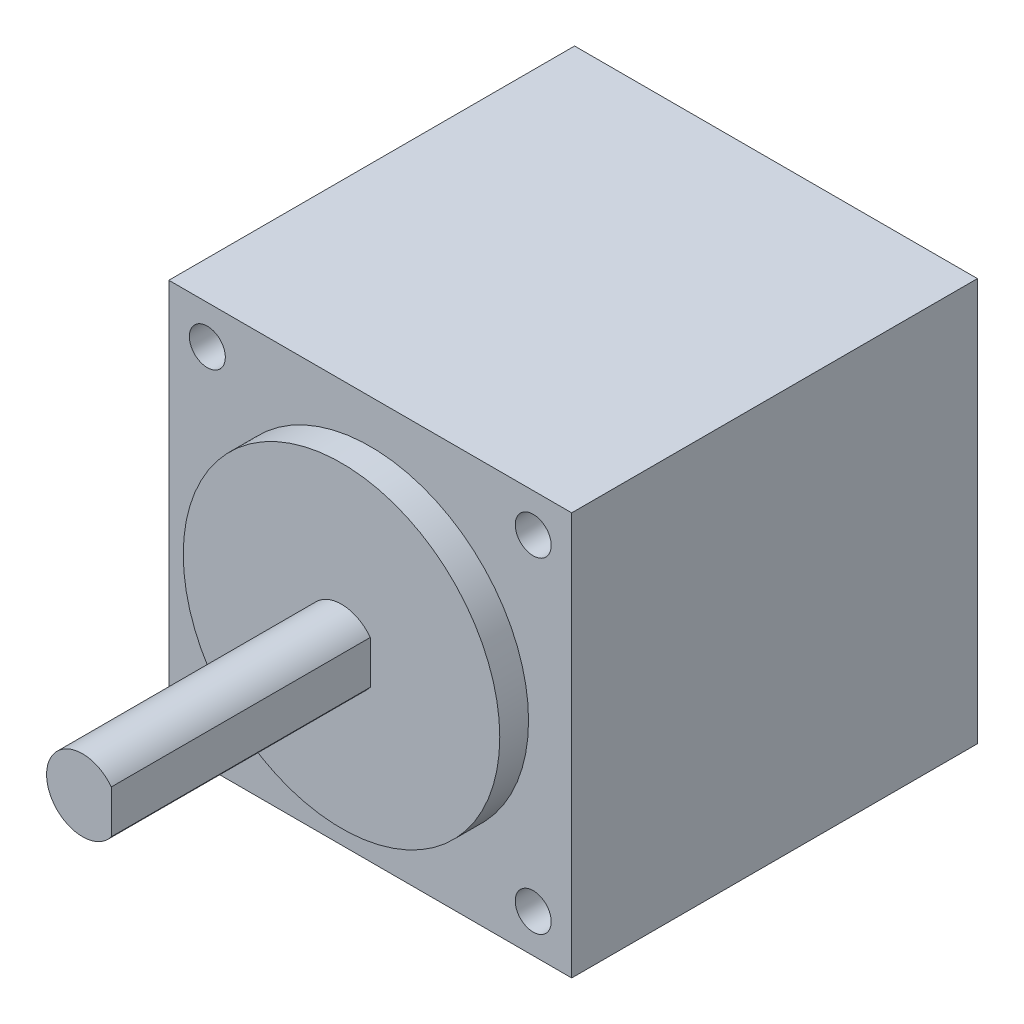
from build123d import *

# Parameters (mm, degrees)
SKETCH2_W                 = 28
SKETCH2_H                 = 28
BOSS_EXTRUDE1_DEPTH       = 28.2
SKETCH3_R                 = 11
BOSS_EXTRUDE2_DEPTH       = 2
SKETCH4_R                 = 2.5
BOSS_EXTRUDE3_DEPTH       = 20
CUT_EXTRUDE1_DEPTH        = 18
F_2_5MM_DOWEL_HOLE1_D     = 2.5
F_2_5MM_DOWEL_HOLE1_DEPTH = 4
F_2_5MM_DOWEL_HOLE1_TIP   = 0.751075774


with BuildPart() as part:
    # Sketch2 → Boss-Extrude1 (new body)
    with BuildSketch(Plane.XY):
        Rectangle(SKETCH2_W, SKETCH2_H)
    extrude(amount=-BOSS_EXTRUDE1_DEPTH)

    # Sketch3 → Boss-Extrude2 (add)
    with BuildSketch(Plane.XY):
        Circle(SKETCH3_R)
    extrude(amount=BOSS_EXTRUDE2_DEPTH)

    # Sketch4 → Boss-Extrude3 (add)
    with BuildSketch(Plane.XY):
        Circle(SKETCH4_R)
    extrude(amount=BOSS_EXTRUDE3_DEPTH)

    # Sketch5 → Cut-Extrude1 (cut)
    with BuildSketch(Plane.XY.offset(20)):
        Polygon((2, 56.05333882), (2, 1.5), (2, -1.5), (2, -56.05333882), (111.10667764, -56.05333882), (111.10667764, 56.05333882), align=None)
    extrude(amount=-CUT_EXTRUDE1_DEPTH, mode=Mode.SUBTRACT)

    # Ø2.5mm Dowel Hole1
    with Locations(Plane.XY):
        with Locations((-11.325, 11.325), (11.325, 11.325), (11.325, -11.325), (-11.325, -11.325)):
            Hole(F_2_5MM_DOWEL_HOLE1_D / 2, depth=F_2_5MM_DOWEL_HOLE1_DEPTH)
            with Locations((0, 0, -(F_2_5MM_DOWEL_HOLE1_DEPTH + F_2_5MM_DOWEL_HOLE1_TIP / 2))):  # 118° drill point
                Cone(0, F_2_5MM_DOWEL_HOLE1_D / 2, F_2_5MM_DOWEL_HOLE1_TIP, mode=Mode.SUBTRACT)


solid = part.part
